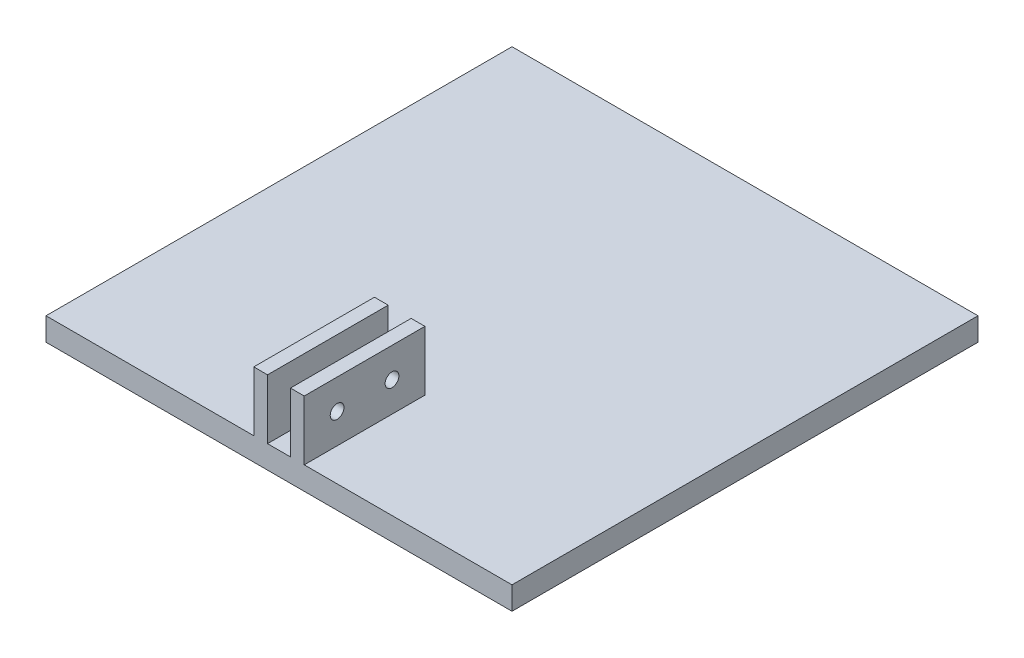
from build123d import *

# Parameters (mm, degrees)
SKETCH1_W           = 101.6
SKETCH1_H           = 101.6
BOSS_EXTRUDE1_DEPTH = 5
SKETCH2_W           = 3
SKETCH2_H           = 26.31
BOSS_EXTRUDE2_DEPTH = 13
SKETCH3_R           = 1.5
CUT_EXTRUDE1_DEPTH  = 13


with BuildPart() as part:
    # Sketch1 → Boss-Extrude1 (new body)
    with BuildSketch(Plane(origin=(0, 0, 0), x_dir=(1, 0, 0), z_dir=(0, 1, 0))):
        Rectangle(SKETCH1_W, SKETCH1_H)
    extrude(amount=BOSS_EXTRUDE1_DEPTH)

    # Sketch2 → Boss-Extrude2 (add)
    with BuildSketch(Plane(origin=(0, 5, 0), x_dir=(1, 0, 0), z_dir=(0, 1, 0))):
        with Locations((-4, -37.645)):
            Rectangle(SKETCH2_W, SKETCH2_H)
        with Locations((4, -37.645)):
            Rectangle(SKETCH2_W, SKETCH2_H)
    extrude(amount=BOSS_EXTRUDE2_DEPTH)

    # Sketch3 → Cut-Extrude1 (cut)
    with BuildSketch(Plane(origin=(5.5, 0, 0), x_dir=(0, 0, -1), z_dir=(1, 0, 0))):
        with Locations((-43.63, 11.5)):
            Circle(SKETCH3_R)
        with Locations((-31.66, 11.5)):
            Circle(SKETCH3_R)
    extrude(amount=-CUT_EXTRUDE1_DEPTH, mode=Mode.SUBTRACT)


solid = part.part
